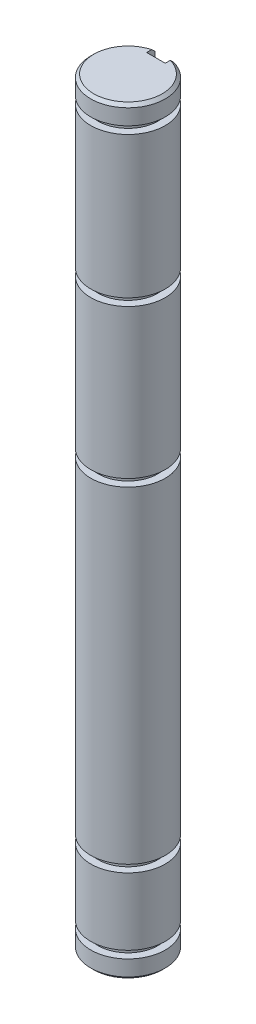
from build123d import *

# Parameters (mm, degrees)
SKETCH2_W          = 3.175
SKETCH2_H          = 1.5875
CUT_EXTRUDE1_DEPTH = 130.660858204


with BuildPart() as part:
    # Sketch1 → Revolve1 (revolve)
    with BuildSketch(Plane.XY):
        Polygon((6.35, 64.16675), (5.842, 64.67475), (0, 64.67475), (0, -64.67475), (5.842, -64.67475), (6.35, -64.16675), (6.35, -61.49975), (5.08, -61.49975), (5.08, -60.22975), (6.35, -60.22975), (6.35, -48.79975), (5.08, -48.79975), (5.08, -47.52975), (6.35, -47.52975), (6.35, 8.15975), (5.08, 8.15975), (5.08, 9.42975), (6.35, 9.42975), (6.35, 34.82975), (5.08, 34.82975), (5.08, 36.09975), (6.35, 36.09975), (6.35, 60.22975), (5.08, 60.22975), (5.08, 61.49975), (6.35, 61.49975), align=None)
    revolve(axis=Axis((0, -64.67475, 0), (0, 1, 0)))

    # Sketch2 → Cut-Extrude1 (cut, through all)
    with BuildSketch(Plane(origin=(0, 64.67475, 0), x_dir=(1, 0, 0), z_dir=(0, 1, 0))):
        with Locations((0, 5.55625)):
            Rectangle(SKETCH2_W, SKETCH2_H)
    extrude(amount=-CUT_EXTRUDE1_DEPTH, mode=Mode.SUBTRACT)


solid = part.part
